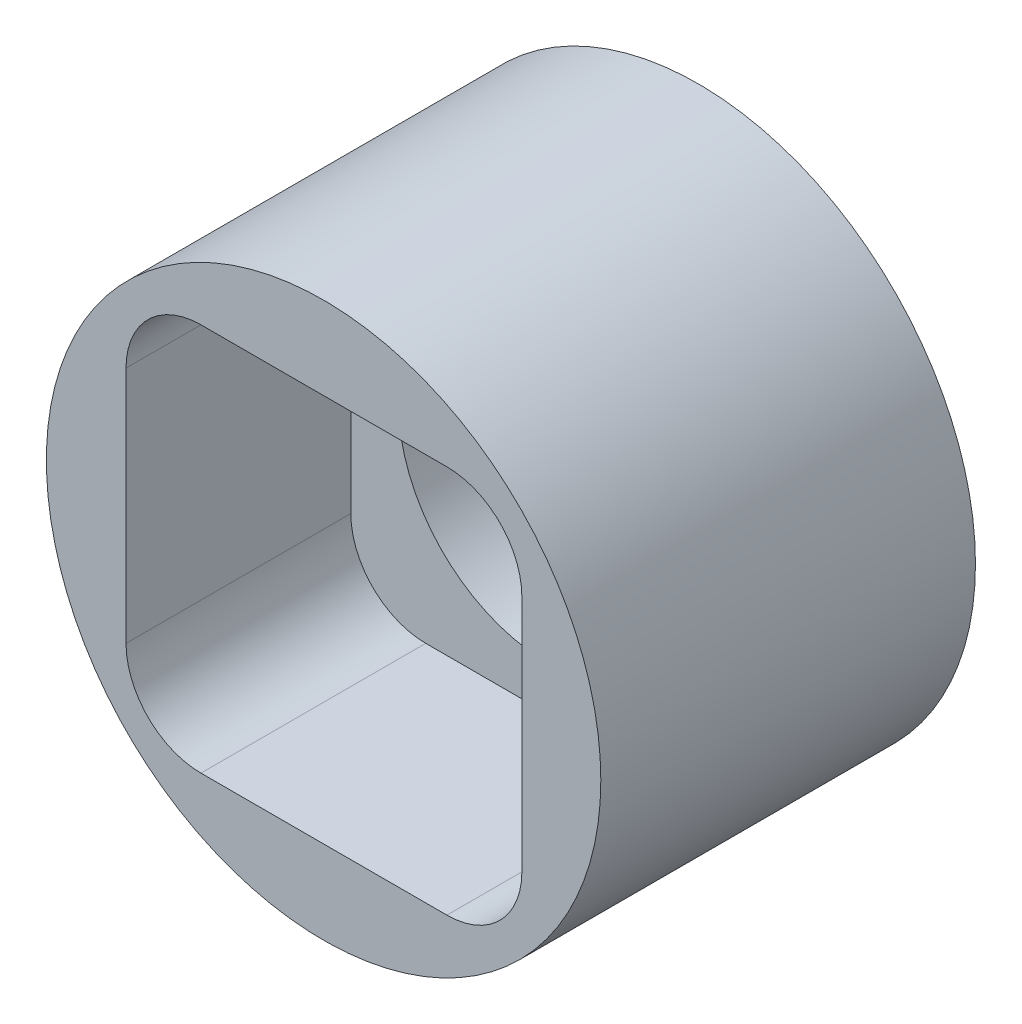
from build123d import *

# Parameters (mm, degrees)
SKETCH_1_R          = 3.7
EXTRUDE_1_DEPTH     = 5
CUT_EXTRUDE_1_DEPTH = 3
SKETCH_3_R          = 2
CUT_EXTRUDE_2_DEPTH = 2


with BuildPart() as part:
    # 草图1 → 凸台-拉伸1 (new body)
    with BuildSketch(Plane.XY):
        Circle(SKETCH_1_R)
    extrude(amount=EXTRUDE_1_DEPTH)

    # 草图2 → 切除-拉伸1 (cut)
    with BuildSketch(Plane.XY.offset(5)):
        with BuildLine():
            Line((-1.636863732, 2.595563457), (1.646192649, 2.595563457))
            ThreePointArc((1.646192649, 2.595563457), (2.35329943, 2.302670238), (2.646192649, 1.595563457))
            Line((2.646192649, 1.595563457), (2.646192649, -1.586051907))
            ThreePointArc((2.646192649, -1.586051907), (2.35329943, -2.293158688), (1.646192649, -2.586051907))
            Line((1.646192649, -2.586051907), (-1.636863732, -2.586051907))
            ThreePointArc((-1.636863732, -2.586051907), (-2.343970513, -2.293158688), (-2.636863732, -1.586051907))
            Line((-2.636863732, -1.586051907), (-2.636863732, 1.595563457))
            ThreePointArc((-2.636863732, 1.595563457), (-2.343970513, 2.302670238), (-1.636863732, 2.595563457))
        make_face()
    extrude(amount=-CUT_EXTRUDE_1_DEPTH, mode=Mode.SUBTRACT)

    # 草图3 → 切除-拉伸2 (cut)
    with BuildSketch(Plane.XY.offset(2)):
        Circle(SKETCH_3_R)
    extrude(amount=-CUT_EXTRUDE_2_DEPTH, mode=Mode.SUBTRACT)


solid = part.part
